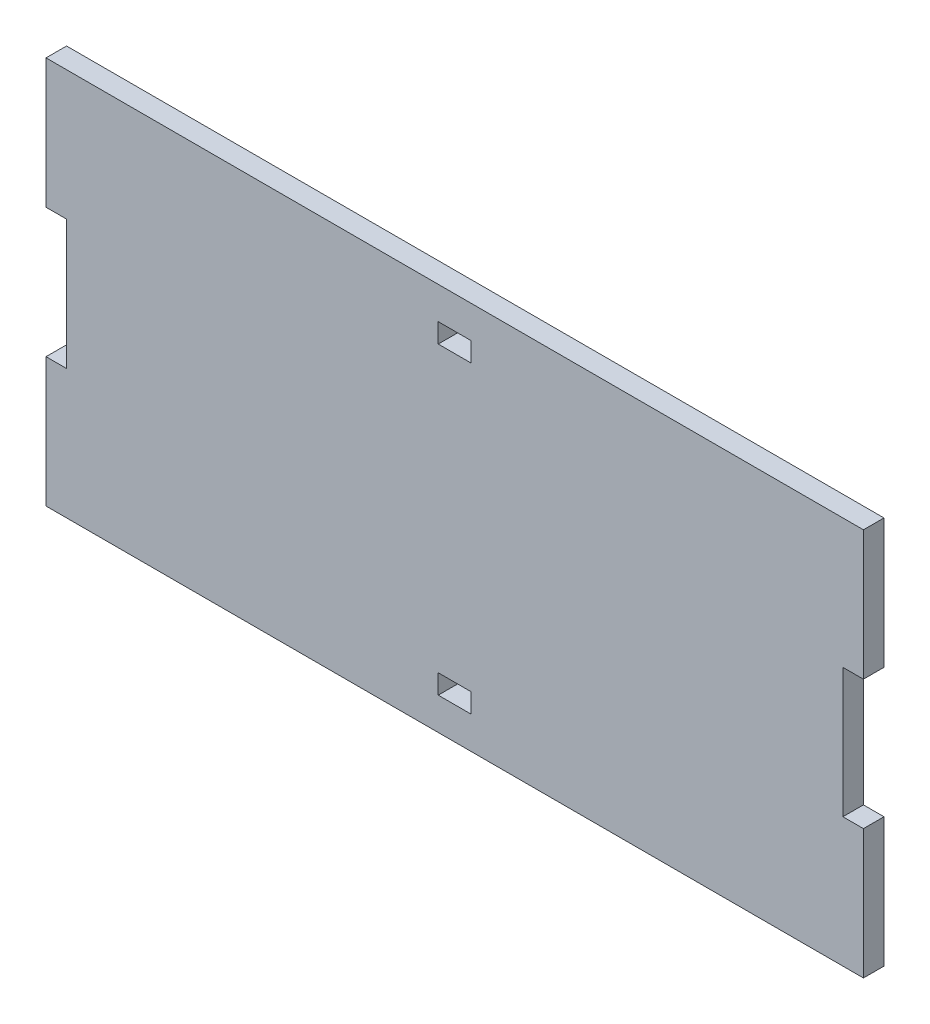
from build123d import *

# Parameters (mm, degrees)
SKETCH1_W           = 5.1
SKETCH1_H           = 3
BOSS_EXTRUDE1_DEPTH = 3.175


with BuildPart() as part:
    # Sketch1 → Boss-Extrude1 (new body)
    with BuildSketch(Plane.XY):
        Polygon((0, 40), (3.175, 40), (3.175, 20), (0, 20), (0, 0), (126.35, 0), (126.35, 20), (123.175, 20), (123.175, 40), (126.35, 40), (126.35, 60), (0, 60), align=None)
        with Locations((63.175, 6.5)):
            Rectangle(SKETCH1_W, SKETCH1_H, mode=Mode.SUBTRACT)
        with Locations((63.175, 53.5)):
            Rectangle(SKETCH1_W, SKETCH1_H, mode=Mode.SUBTRACT)
    extrude(amount=BOSS_EXTRUDE1_DEPTH)


solid = part.part
